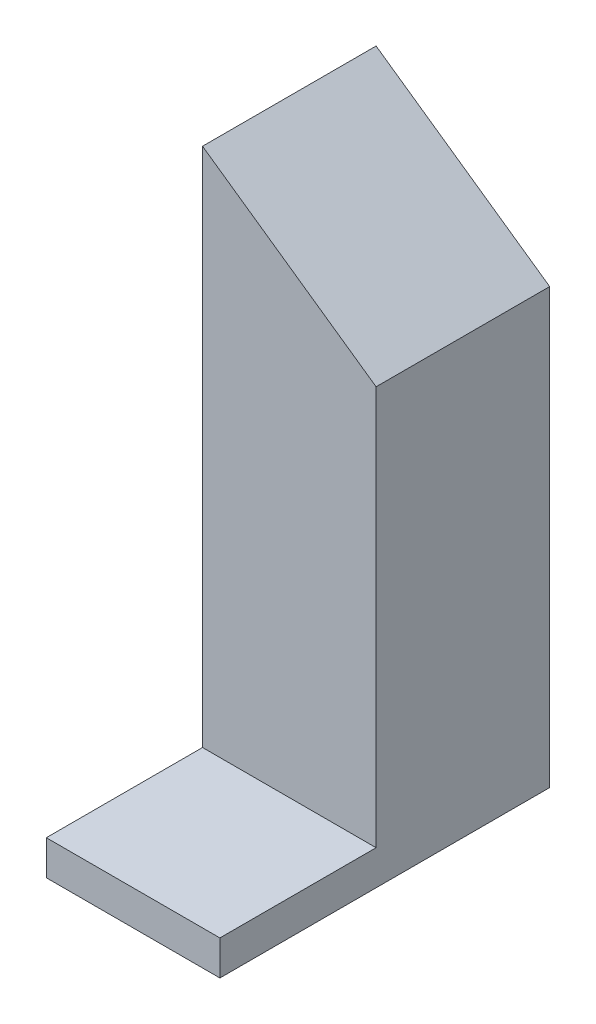
from build123d import *

# Parameters (mm, degrees)
BOSS_EXTRUDE1_DEPTH = 5
SKETCH2_W           = 5
SKETCH2_H           = 9.5
BOSS_EXTRUDE2_DEPTH = 1


with BuildPart() as part:
    # Sketch1 → Boss-Extrude1 (new body)
    with BuildSketch(Plane.XY):
        Polygon((0, 0), (0, 5), (5, 1.498962309), (5, -10), (0, -10), align=None)
    extrude(amount=BOSS_EXTRUDE1_DEPTH)

    # Sketch2 → Boss-Extrude2 (add)
    with BuildSketch(Plane.XZ.offset(10)):
        with Locations((2.5, 4.75)):
            Rectangle(SKETCH2_W, SKETCH2_H)
    extrude(amount=BOSS_EXTRUDE2_DEPTH)


solid = part.part
